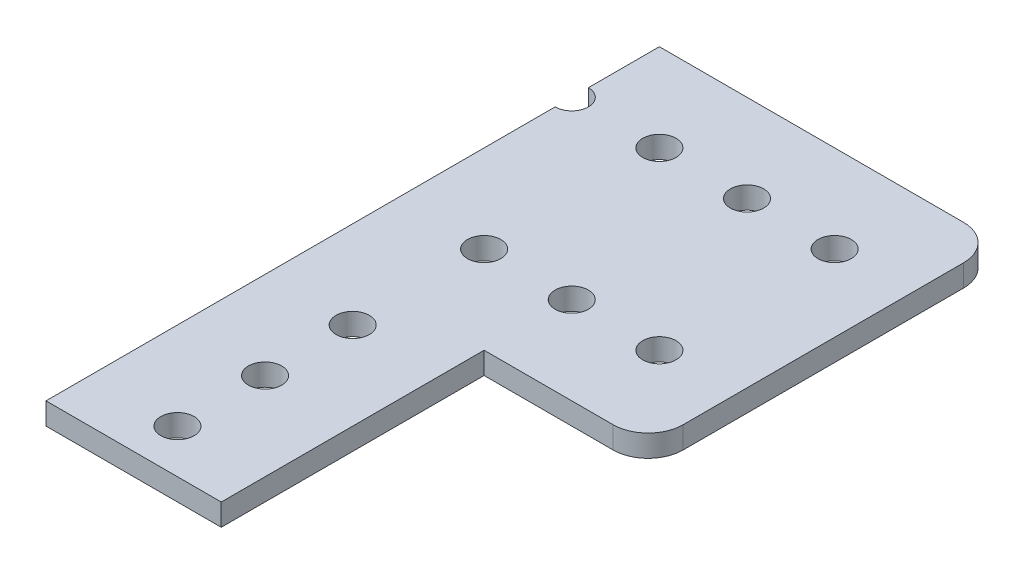
from build123d import *

# Parameters (mm, degrees)
BOSS_EXTRUDE1_DEPTH = 3.175
FILLET1_R           = 5.08
SKETCH2_R           = 2.413
SKETCH2_W           = 25.4
SKETCH2_H           = 12.7
CUT_EXTRUDE1_DEPTH  = 113.917603541
SKETCH3_W           = 27.94
SKETCH3_H           = 50.8
CUT_EXTRUDE2_DEPTH  = 113.917603541


with BuildPart() as part:
    # Sketch1 → Boss-Extrude1 (new body)
    with BuildSketch(Plane(origin=(0, 0, 0), x_dir=(1, 0, 0), z_dir=(0, 1, 0))):
        Polygon((25.4, 50.8), (49.170566038, 50.8), (49.170566038, 101.6), (-27.029433962, 101.6), (-27.029433962, 50.8), (0, 50.8), (0, 0), (25.4, 0), align=None)
    extrude(amount=BOSS_EXTRUDE1_DEPTH)

    # Fillet1
    fillet1_edges = [part.edges().sort_by_distance(p)[0] for p in [
        (-27.029433962, 1.5875, -50.8),
        (-27.029433962, 1.5875, -101.6),
        (49.170566038, 1.5875, -101.6),
        (49.170566038, 1.5875, -50.8),
        (25.4, 1.5875, 0),
        (0, 1.5875, 0),
    ]]
    fillet(fillet1_edges, radius=FILLET1_R)

    # Sketch2 → Cut-Extrude1 (cut, through all)
    with BuildSketch(Plane(origin=(0, 3.175, 0), x_dir=(1, 0, 0), z_dir=(0, 1, 0))):
        with Locations(Location((12.7, 19.05, 0), (0, 0, 270))):
            Circle(SKETCH2_R)
        with Locations(Location((12.7, 31.75, 0), (0, 0, 270))):
            Circle(SKETCH2_R)
        with Locations(Location((12.7, 44.45, 0), (0, 0, 270))):
            Circle(SKETCH2_R)
        with Locations(Location((-12.698753962, 88.9, 0), (0, 0, 270))):
            Circle(SKETCH2_R)
        with Locations(Location((0.001246038, 88.9, 0), (0, 0, 270))):
            Circle(SKETCH2_R)
        with Locations(Location((12.701246038, 88.9, 0), (0, 0, 270))):
            Circle(SKETCH2_R)
        with Locations(Location((25.401246038, 88.9, 0), (0, 0, 270))):
            Circle(SKETCH2_R)
        with Locations(Location((38.101246038, 88.9, 0), (0, 0, 270))):
            Circle(SKETCH2_R)
        with Locations(Location((12.701246038, 63.5, 0), (0, 0, 270))):
            Circle(SKETCH2_R)
        with Locations(Location((25.401246038, 63.5, 0), (0, 0, 270))):
            Circle(SKETCH2_R)
        with Locations(Location((38.101246038, 63.5, 0), (0, 0, 270))):
            Circle(SKETCH2_R)
        with Locations((12.7, 6.35)):
            Rectangle(SKETCH2_W, SKETCH2_H)
    extrude(amount=-CUT_EXTRUDE1_DEPTH, mode=Mode.SUBTRACT)

    # Sketch3 → Cut-Extrude2 (cut, through all)
    with BuildSketch(Plane(origin=(0, 3.175, 0), x_dir=(1, 0, 0), z_dir=(0, 1, 0))):
        with Locations((-13.97, 76.2)):
            Rectangle(SKETCH3_W, SKETCH3_H)
    extrude(amount=-CUT_EXTRUDE2_DEPTH, mode=Mode.SUBTRACT)


solid = part.part
